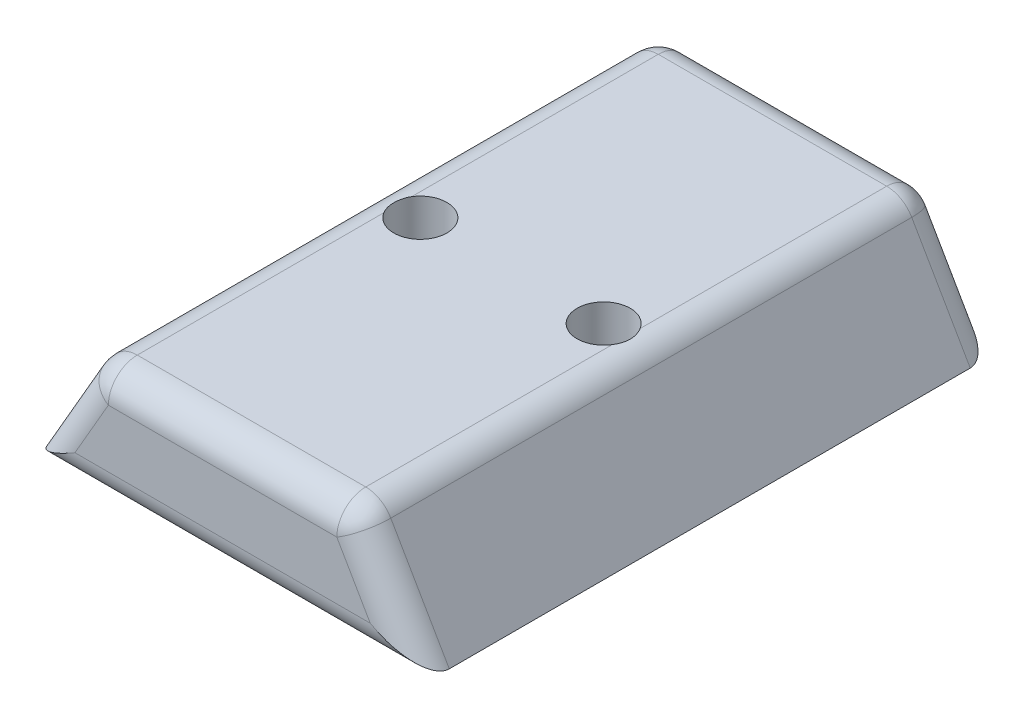
from build123d import *

# Parameters (mm, degrees)
BOSS_EXTRUDE1_DEPTH                          = 60
FILLET1_R                                    = 3
CBORE_FOR_M5_HEX_SOCKET_HEAD_CAP_SCR_2_COUNT = 2
CBORE_FOR_M5_HEX_SOCKET_HEAD_CAP_SCR_2_PITCH = 19


with BuildPart() as part:
    # Sketch1 → Boss-Extrude1 (new body)
    with BuildSketch(Plane.XY):
        Polygon((-20.5, 0), (-13.57179677, 12), (13.57179677, 12), (20.5, 0), align=None)
    extrude(amount=BOSS_EXTRUDE1_DEPTH)

    # Fillet1
    fillet1_edges = [part.edges().sort_by_distance(p)[0] for p in [
        (0, 12, 60),
        (-17.035898385, 6, 60),
        (0, 0, 60),
        (-17.035898385, 6, 0),
        (0, 12, 0),
        (17.035898385, 6, 0),
        (0, 0, 0),
        (-13.57179677, 12, 30),
        (13.57179677, 12, 30),
        (17.035898385, 6, 60),
    ]]
    fillet(fillet1_edges, radius=FILLET1_R)

    # Sketch5 → CBORE for M5 Hex Socket Head Cap Screw1 (revolve, cut)
    with BuildSketch(Plane(origin=(9.5, 0, 30), x_dir=(0, 0, -1), z_dir=(1, 0, 0))):
        Polygon((0, 0), (0, 12), (2.75, 12), (2.75, 5.4), (5, 5.4), (5, 0.025), (5.025, 0), align=None)
    cbore_for_m5_hex_socket_head_cap_screw1 = revolve(axis=Axis((9.5, -6.35, 30), (0, 1, 0)), mode=Mode.SUBTRACT)

    # CBORE for M5 Hex Socket Head Cap Scr 2: CBORE for M5 Hex Socket Head Cap Screw1 ×2
    with Locations(*[(-i * CBORE_FOR_M5_HEX_SOCKET_HEAD_CAP_SCR_2_PITCH, 0, 0) for i in range(1, CBORE_FOR_M5_HEX_SOCKET_HEAD_CAP_SCR_2_COUNT)]):
        add(cbore_for_m5_hex_socket_head_cap_screw1, mode=Mode.SUBTRACT)


solid = part.part
